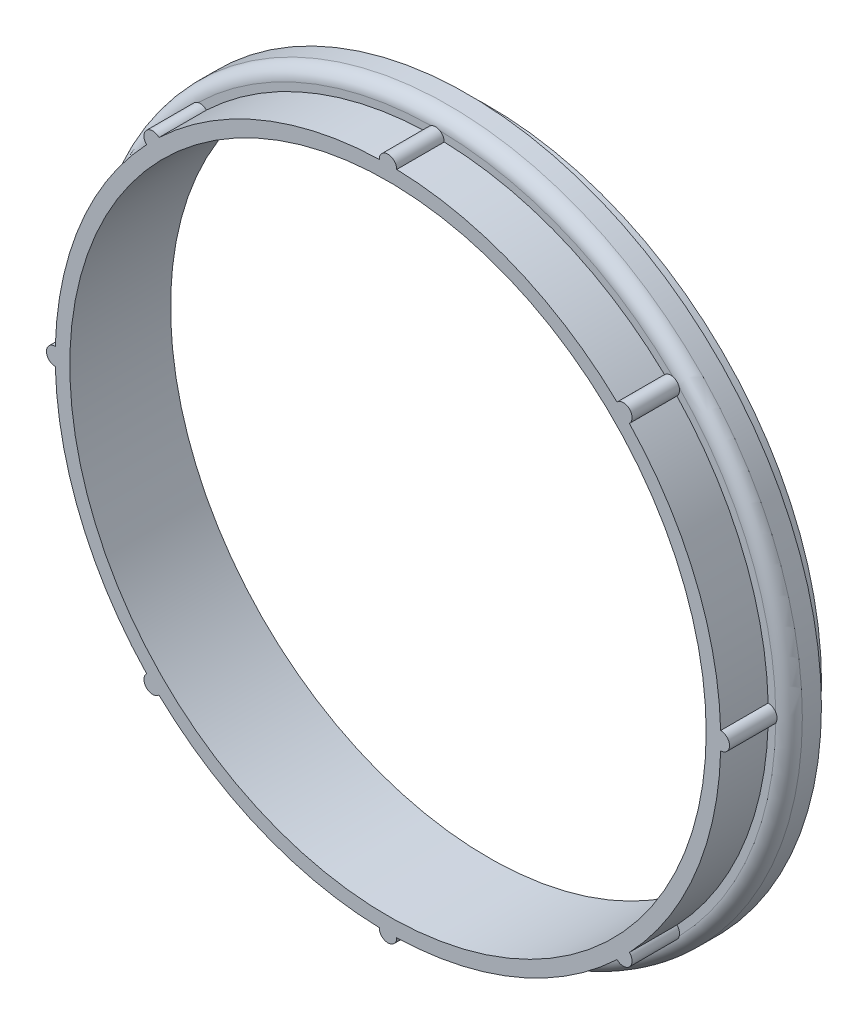
from build123d import *

# Parameters (mm, degrees)
SKETCH1_R           = 47.8155
SKETCH1_R_2         = 45.72
BOSS_EXTRUDE1_DEPTH = 7.239
SKETCH2_R           = 53.975
SKETCH2_R_2         = 47.8155
BOSS_EXTRUDE2_DEPTH = 0.41275
BOSS_EXTRUDE3_REACH = 79.693
SKETCH3_R           = 1.256285172
CIRPATTERN1_COUNT   = 8
MOVE_FACE1_BY       = 5.08


with BuildPart() as part:
    # Sketch1 → Boss-Extrude1 (new, symmetric)
    with BuildSketch(Plane.XY):
        Circle(SKETCH1_R)
        Circle(SKETCH1_R_2, mode=Mode.SUBTRACT)
    extrude(amount=BOSS_EXTRUDE1_DEPTH, both=True)

    # Sketch2 → Boss-Extrude2 (add, symmetric)
    with BuildSketch(Plane.XY):
        with Locations(Location((0, 0, 0), (0, 0, 180))):
            Circle(SKETCH2_R)
        Circle(SKETCH2_R_2, mode=Mode.SUBTRACT)
    extrude(amount=BOSS_EXTRUDE2_DEPTH, both=True)

    # Sketch3 → Boss-Extrude3 (add, up to next)
    with BuildSketch(Plane.XY.offset(7.239), mode=Mode.PRIVATE) as boss_extrude3_sk1:
        with Locations((0, 47.8155)):
            Circle(SKETCH3_R)
    boss_extrude3_tool1 = extrude(boss_extrude3_sk1.sketch, amount=-BOSS_EXTRUDE3_REACH, mode=Mode.PRIVATE) - part.part
    boss_extrude3 = boss_extrude3_tool1.solids().sort_by_distance((0, 47.8155, 7.239))[0]
    add(boss_extrude3)

    # CirPattern1: Boss-Extrude3 ×8 about axis
    cirpattern1_axis = Axis((0, 0, 0), (0, 0, 1))
    for i in range(1, CIRPATTERN1_COUNT):
        add(boss_extrude3.rotate(cirpattern1_axis, i * 360 / CIRPATTERN1_COUNT))

    # Move Face1: a curved face moved inward by 5.08
    add(Solid.thicken(part.faces().sort_by_distance((53.975, 0, 0))[0], -MOVE_FACE1_BY), mode=Mode.SUBTRACT)

    # Sketch4 → Revolve2 (revolve)
    with BuildSketch(Plane(origin=(0, 0, 0), x_dir=(0, 0, -1), z_dir=(1, 0, 0)), mode=Mode.PRIVATE) as revolve2_sk:
        with BuildLine():
            Line((-0.41275, 48.890682026), (0.41275, 48.890682026))
            ThreePointArc((0.41275, 48.890682026), (0.730192935, 49.657057065), (1.496567974, 49.9745))
            Line((1.496567974, 49.9745), (4.240158679, 49.9745))
            Line((4.240158679, 49.9745), (4.240158679, 50.8))
            Line((4.240158679, 50.8), (1.496567974, 50.8))
            ThreePointArc((1.496567974, 50.8), (0.146476287, 50.240773713), (-0.41275, 48.890682026))
        make_face()
    revolve(revolve2_sk.sketch.rotate(Axis((0, 0, -29.740513721), (0, 0, 1)), 90), axis=Axis((0, 0, -29.740513721), (0, 0, 1)))


solid = part.part
